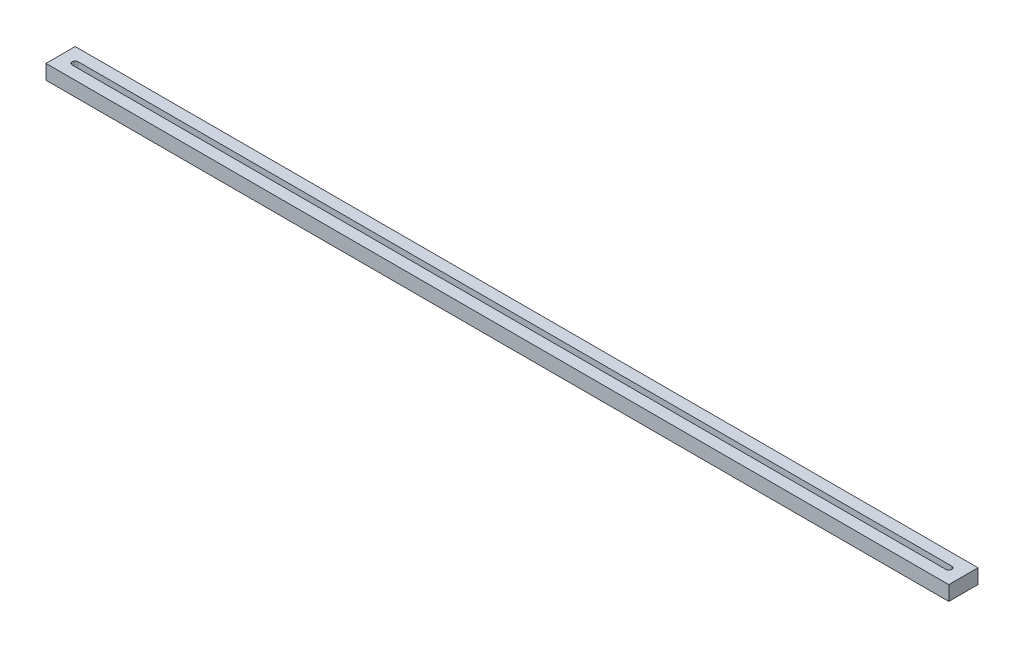
from build123d import *

# Parameters (mm, degrees)
SKETCH1_W           = 309
SKETCH1_H           = 10
BOSS_EXTRUDE1_DEPTH = 5


with BuildPart() as part:
    # Sketch1 → Boss-Extrude1 (new body)
    with BuildSketch(Plane(origin=(0, 0, 0), x_dir=(1, 0, 0), z_dir=(0, 1, 0))):
        with Locations((164.975510873, 13.11854725)):
            Rectangle(SKETCH1_W, SKETCH1_H)
        with BuildLine():
            Line((15.475510873, 14.11854725), (314.475510873, 14.11854725))
            ThreePointArc((314.475510873, 14.11854725), (315.475510873, 13.11854725), (314.475510873, 12.11854725))
            Line((314.475510873, 12.11854725), (15.475510873, 12.11854725))
            ThreePointArc((15.475510873, 12.11854725), (14.475510873, 13.11854725), (15.475510873, 14.11854725))
        make_face(mode=Mode.SUBTRACT)
    extrude(amount=BOSS_EXTRUDE1_DEPTH)


solid = part.part
